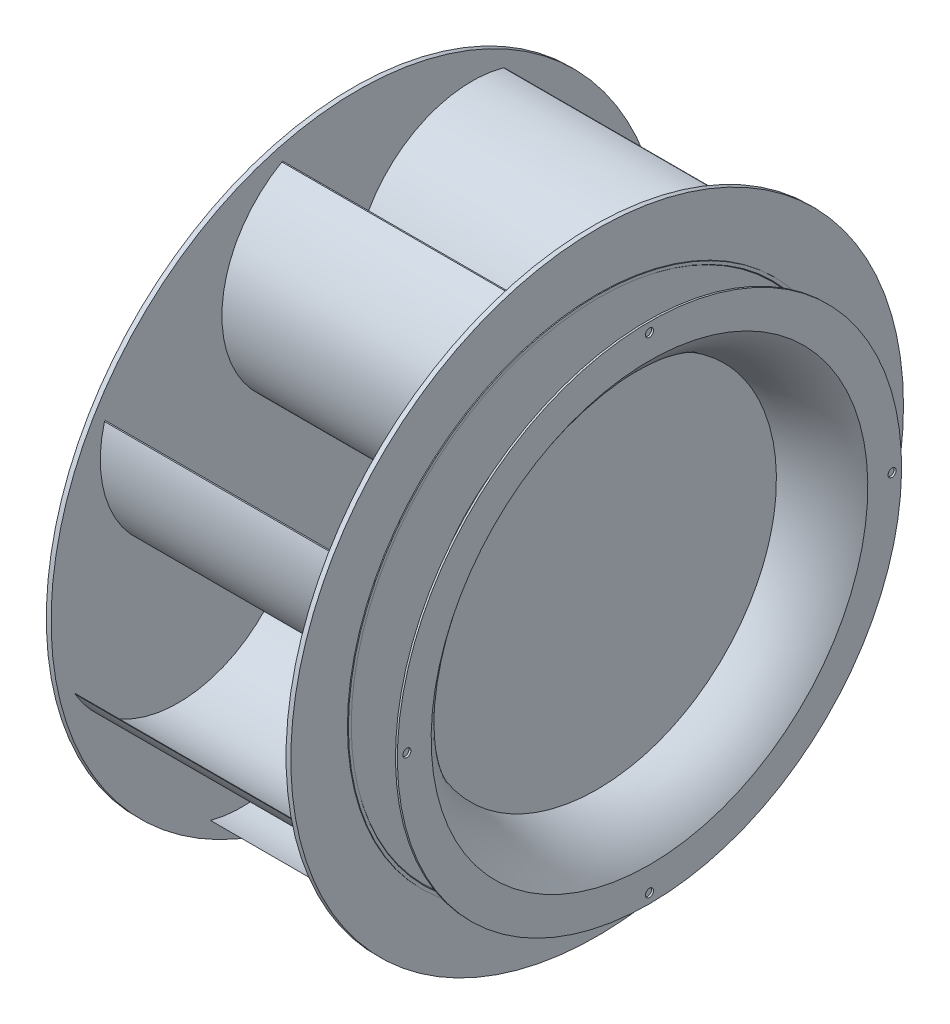
from build123d import *

# Parameters (mm, degrees)
SKETCH2_R         = 322
EXTRUDE1_DEPTH    = 5
SKETCH9_R         = 317
SKETCH9_R_2       = 100
EXTRUDE7_DEPTH    = 3
SKETCH3_R         = 322
EXTRUDE2_DEPTH    = 5
EXTRUDE3_DEPTH    = 252
CIRPATTERN1_COUNT = 8
SKETCH7_R         = 4.25
EXTRUDE5_DEPTH    = 5
CIRPATTERN2_COUNT = 4
SKETCH8_R         = 5
EXTRUDE6_DEPTH    = 90
CIRPATTERN3_COUNT = 8


with BuildPart() as part:
    # Sketch1 → Revolve1 (revolve)
    with BuildSketch(Plane.XY, mode=Mode.PRIVATE) as revolve1_sk:
        with BuildLine():
            Line((0, 0), (0, 109))
            ThreePointArc((0, 109), (1.464466094, 112.535533906), (5, 114))
            Line((5, 114), (70, 114))
            Line((70, 114), (70, 138))
            Line((70, 138), (90, 138))
            Line((90, 138), (90, 98))
            Line((90, 98), (95, 98))
            Line((95, 98), (95, 133))
            Line((95, 133), (105, 133))
            Line((105, 133), (105, 98))
            Line((105, 98), (129, 98))
            Line((129, 98), (129, 0))
            Line((129, 0), (0, 0))
        make_face()
    revolve(revolve1_sk.sketch.rotate(Axis((0, 0, 0), (1, 0, 0)), 90), axis=Axis((0, 0, 0), (1, 0, 0)))

    # Sketch2 → Extrude1 (add)
    with BuildSketch(Plane(origin=(129, 0, 0), x_dir=(0, 0, -1), z_dir=(1, 0, 0))):
        Circle(SKETCH2_R)
    extrude(amount=EXTRUDE1_DEPTH)

    # Sketch9 → Extrude7 (cut)
    with BuildSketch(Plane.ZY.offset(-129)):
        Circle(SKETCH9_R)
        Circle(SKETCH9_R_2, mode=Mode.SUBTRACT)
    extrude(amount=-EXTRUDE7_DEPTH, mode=Mode.SUBTRACT)



with BuildPart() as body_2:
    # Sketch3 → Extrude2 (new body)
    with BuildSketch(Plane(origin=(381, 0, 0), x_dir=(0, 0, -1), z_dir=(1, 0, 0))):
        Circle(SKETCH3_R)
    extrude(amount=EXTRUDE2_DEPTH)


with BuildPart() as part_1:
    add(part.part)

    add(body_2.part)  # Extrude3 merges body 2
    # Sketch4 → Extrude3 (add)
    with BuildSketch(Plane(origin=(134, 0, 0), x_dir=(0, 0, -1), z_dir=(1, 0, 0))):
        with BuildLine():
            Line((0, 112.5), (0.866025404, 112))
            ThreePointArc((0.866025404, 112), (33.143390798, 233.195288477), (154.366025404, 265.369798962))
            Line((154.366025404, 265.369798962), (153.5, 265.869798962))
            ThreePointArc((153.5, 265.869798962), (32.277365394, 233.695288477), (0, 112.5))
        make_face()
    extrude3 = extrude(amount=EXTRUDE3_DEPTH)

    # CirPattern1: Extrude3 ×8 about axis
    cirpattern1_axis = Axis((0, 0, 0), (1, 0, 0))
    for i in range(1, CIRPATTERN1_COUNT):
        add(extrude3.rotate(cirpattern1_axis, i * 360 / CIRPATTERN1_COUNT))

    # Sketch5 → Revolve2 (revolve)
    with BuildSketch(Plane.XY, mode=Mode.PRIVATE) as revolve2_sk:
        with BuildLine():
            Line((386, 262.5), (387, 262.5))
            Line((387, 262.5), (387, 259.5))
            ThreePointArc((387, 259.5), (361.120460876, 225.340877355), (360, 182.5))
            Line((360, 182.5), (360, 181.5))
            ThreePointArc((360, 181.5), (360.341587738, 224.719470754), (386, 259.5))
            Line((386, 259.5), (386, 262.5))
        make_face()
    revolve(revolve2_sk.sketch.rotate(Axis((0, 0, 0), (1, 0, 0)), 90), axis=Axis((0, 0, 0), (1, 0, 0)))

    # Sketch8 → Extrude6 (cut)
    with BuildSketch(Plane(origin=(0, 0, 0), x_dir=(0, 0, -1), z_dir=(1, 0, 0))):
        with Locations(Location((0, 126, 0), (0, 0, 180))):
            Circle(SKETCH8_R)
    extrude6 = extrude(amount=EXTRUDE6_DEPTH, mode=Mode.SUBTRACT)

    # CirPattern3: Extrude6 ×8 about axis
    cirpattern3_axis = Axis((0, 0, 0), (1, 0, 0))
    for i in range(1, CIRPATTERN3_COUNT):
        add(extrude6.rotate(cirpattern3_axis, i * 360 / CIRPATTERN3_COUNT), mode=Mode.SUBTRACT)


with BuildPart() as body_2_2:
    # Sketch6 → Revolve3 (revolve)
    with BuildSketch(Plane.XY, mode=Mode.PRIVATE) as revolve3_sk:
        with BuildLine():
            Line((441, 265), (439, 265))
            Line((439, 265), (439, 229.5))
            ThreePointArc((439, 229.5), (396.064401628, 194.349729535), (341, 187.5))
            Line((341, 187.5), (337, 187.5))
            Line((337, 187.5), (337, 185.5))
            Line((337, 185.5), (341, 185.5))
            ThreePointArc((341, 185.5), (397.53984426, 192.636717591), (441, 229.5))
            Line((441, 229.5), (441, 265))
        make_face()
    revolve(revolve3_sk.sketch.rotate(Axis((0, 0, 0), (1, 0, 0)), 180), axis=Axis((0, 0, 0), (1, 0, 0)))

    # Sketch7 → Extrude5 (cut)
    with BuildSketch(Plane(origin=(441, 0, 0), x_dir=(0, 0, -1), z_dir=(1, 0, 0))):
        with Locations((0, 255)):
            Circle(SKETCH7_R)
    extrude5 = extrude(amount=-EXTRUDE5_DEPTH, mode=Mode.SUBTRACT)

    # CirPattern2: Extrude5 ×4 about axis
    cirpattern2_axis = Axis((0, 0, 0), (1, 0, 0))
    for i in range(1, CIRPATTERN2_COUNT):
        add(extrude5.rotate(cirpattern2_axis, i * 360 / CIRPATTERN2_COUNT), mode=Mode.SUBTRACT)


solid = Compound([part_1.part, body_2_2.part])
